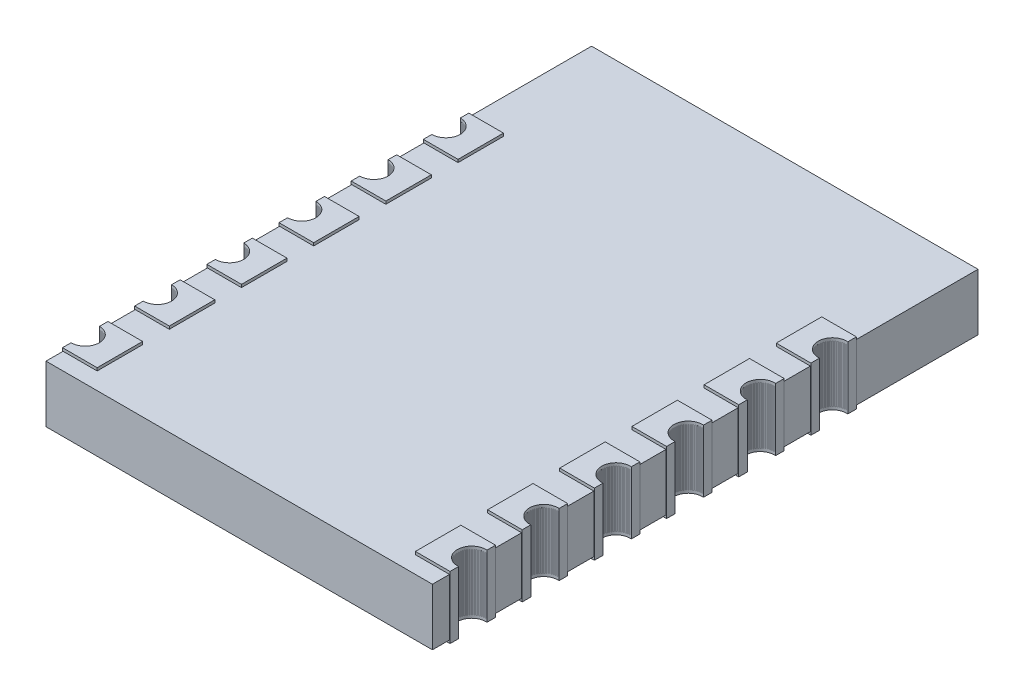
from build123d import *

# Parameters (mm, degrees)
SKETCH_1_W              = 6.8
SKETCH_1_H              = 9.6
EXTRUDE_1_DEPTH         = 1
EXTRUDE_2_DEPTH         = 0.05
EXTRUDE_2_DEPTH_BACK    = 1.05
SKETCH_2_W              = 0.61
SKETCH_2_H              = 0.8
EXTRUDE_2_2_DEPTH       = 0.05
EXTRUDE_2_2_DEPTH_BACK  = 1.05
EXTRUDE_2_3_DEPTH       = 0.05
EXTRUDE_2_3_DEPTH_BACK  = 1.05
EXTRUDE_2_4_DEPTH       = 0.05
EXTRUDE_2_4_DEPTH_BACK  = 1.05
EXTRUDE_2_5_DEPTH       = 0.05
EXTRUDE_2_5_DEPTH_BACK  = 1.05
EXTRUDE_2_6_DEPTH       = 0.05
EXTRUDE_2_6_DEPTH_BACK  = 1.05
EXTRUDE_2_7_DEPTH       = 0.05
EXTRUDE_2_7_DEPTH_BACK  = 1.05
EXTRUDE_2_8_DEPTH       = 0.05
EXTRUDE_2_8_DEPTH_BACK  = 1.05
EXTRUDE_2_9_DEPTH       = 0.05
EXTRUDE_2_9_DEPTH_BACK  = 1.05
EXTRUDE_2_10_DEPTH      = 0.05
EXTRUDE_2_10_DEPTH_BACK = 1.05
EXTRUDE_2_11_DEPTH      = 0.05
EXTRUDE_2_11_DEPTH_BACK = 1.05
EXTRUDE_2_12_DEPTH      = 0.05
EXTRUDE_2_12_DEPTH_BACK = 1.05
SKETCH_4_R              = 0.25
CUT_EXTRUDE_2_DEPTH     = 12.821425464


with BuildPart() as part:
    # 草图1 → 凸台-拉伸1 (new body)
    with BuildSketch(Plane(origin=(0, 0, 0), x_dir=(1, 0, 0), z_dir=(0, 1, 0))):
        with Locations((3.4, 4.8)):
            Rectangle(SKETCH_1_W, SKETCH_1_H)
    extrude(amount=EXTRUDE_1_DEPTH)


with BuildPart() as body_2:
    # 草图2 → 凸台-拉伸2 (new, two sides: drawn at the far end of the back side and taken through both)
    with BuildSketch(Plane(origin=(0, 1, 0), x_dir=(1, 0, 0), z_dir=(0, 1, 0)).offset(-EXTRUDE_2_DEPTH_BACK)):
        with Locations((0.295, 0.7)):
            Rectangle(SKETCH_2_W, SKETCH_2_H)
    extrude(amount=EXTRUDE_2_DEPTH + EXTRUDE_2_DEPTH_BACK)


with BuildPart() as body_3:
    # 草图2 → Extrude 2 2 (new, two sides: drawn at the far end of the back side and taken through both)
    with BuildSketch(Plane(origin=(0, 1, 0), x_dir=(1, 0, 0), z_dir=(0, 1, 0)).offset(-EXTRUDE_2_2_DEPTH_BACK)):
        with Locations((0.295, 1.97)):
            Rectangle(SKETCH_2_W, SKETCH_2_H)
    extrude(amount=EXTRUDE_2_2_DEPTH + EXTRUDE_2_2_DEPTH_BACK)


with BuildPart() as body_4:
    # 草图2 → Extrude 2 3 (new, two sides: drawn at the far end of the back side and taken through both)
    with BuildSketch(Plane(origin=(0, 1, 0), x_dir=(1, 0, 0), z_dir=(0, 1, 0)).offset(-EXTRUDE_2_3_DEPTH_BACK)):
        with Locations((0.295, 3.24)):
            Rectangle(SKETCH_2_W, SKETCH_2_H)
    extrude(amount=EXTRUDE_2_3_DEPTH + EXTRUDE_2_3_DEPTH_BACK)


with BuildPart() as body_5:
    # 草图2 → Extrude 2 4 (new, two sides: drawn at the far end of the back side and taken through both)
    with BuildSketch(Plane(origin=(0, 1, 0), x_dir=(1, 0, 0), z_dir=(0, 1, 0)).offset(-EXTRUDE_2_4_DEPTH_BACK)):
        with Locations((0.295, 4.51)):
            Rectangle(SKETCH_2_W, SKETCH_2_H)
    extrude(amount=EXTRUDE_2_4_DEPTH + EXTRUDE_2_4_DEPTH_BACK)


with BuildPart() as body_6:
    # 草图2 → Extrude 2 5 (new, two sides: drawn at the far end of the back side and taken through both)
    with BuildSketch(Plane(origin=(0, 1, 0), x_dir=(1, 0, 0), z_dir=(0, 1, 0)).offset(-EXTRUDE_2_5_DEPTH_BACK)):
        with Locations((0.295, 5.78)):
            Rectangle(SKETCH_2_W, SKETCH_2_H)
    extrude(amount=EXTRUDE_2_5_DEPTH + EXTRUDE_2_5_DEPTH_BACK)


with BuildPart() as body_7:
    # 草图2 → Extrude 2 6 (new, two sides: drawn at the far end of the back side and taken through both)
    with BuildSketch(Plane(origin=(0, 1, 0), x_dir=(1, 0, 0), z_dir=(0, 1, 0)).offset(-EXTRUDE_2_6_DEPTH_BACK)):
        with Locations((0.295, 7.05)):
            Rectangle(SKETCH_2_W, SKETCH_2_H)
    extrude(amount=EXTRUDE_2_6_DEPTH + EXTRUDE_2_6_DEPTH_BACK)


with BuildPart() as body_8:
    # 草图2 → Extrude 2 7 (new, two sides: drawn at the far end of the back side and taken through both)
    with BuildSketch(Plane(origin=(0, 1, 0), x_dir=(1, 0, 0), z_dir=(0, 1, 0)).offset(-EXTRUDE_2_7_DEPTH_BACK)):
        with Locations((6.505, 7.05)):
            Rectangle(SKETCH_2_W, SKETCH_2_H)
    extrude(amount=EXTRUDE_2_7_DEPTH + EXTRUDE_2_7_DEPTH_BACK)


with BuildPart() as body_9:
    # 草图2 → Extrude 2 8 (new, two sides: drawn at the far end of the back side and taken through both)
    with BuildSketch(Plane(origin=(0, 1, 0), x_dir=(1, 0, 0), z_dir=(0, 1, 0)).offset(-EXTRUDE_2_8_DEPTH_BACK)):
        with Locations((6.505, 5.78)):
            Rectangle(SKETCH_2_W, SKETCH_2_H)
    extrude(amount=EXTRUDE_2_8_DEPTH + EXTRUDE_2_8_DEPTH_BACK)


with BuildPart() as body_10:
    # 草图2 → Extrude 2 9 (new, two sides: drawn at the far end of the back side and taken through both)
    with BuildSketch(Plane(origin=(0, 1, 0), x_dir=(1, 0, 0), z_dir=(0, 1, 0)).offset(-EXTRUDE_2_9_DEPTH_BACK)):
        with Locations((6.505, 4.51)):
            Rectangle(SKETCH_2_W, SKETCH_2_H)
    extrude(amount=EXTRUDE_2_9_DEPTH + EXTRUDE_2_9_DEPTH_BACK)


with BuildPart() as body_11:
    # 草图2 → Extrude 2 10 (new, two sides: drawn at the far end of the back side and taken through both)
    with BuildSketch(Plane(origin=(0, 1, 0), x_dir=(1, 0, 0), z_dir=(0, 1, 0)).offset(-EXTRUDE_2_10_DEPTH_BACK)):
        with Locations((6.505, 3.24)):
            Rectangle(SKETCH_2_W, SKETCH_2_H)
    extrude(amount=EXTRUDE_2_10_DEPTH + EXTRUDE_2_10_DEPTH_BACK)


with BuildPart() as body_12:
    # 草图2 → Extrude 2 11 (new, two sides: drawn at the far end of the back side and taken through both)
    with BuildSketch(Plane(origin=(0, 1, 0), x_dir=(1, 0, 0), z_dir=(0, 1, 0)).offset(-EXTRUDE_2_11_DEPTH_BACK)):
        with Locations((6.505, 0.7)):
            Rectangle(SKETCH_2_W, SKETCH_2_H)
    extrude(amount=EXTRUDE_2_11_DEPTH + EXTRUDE_2_11_DEPTH_BACK)


with BuildPart() as body_13:
    # 草图2 → Extrude 2 12 (new, two sides: drawn at the far end of the back side and taken through both)
    with BuildSketch(Plane(origin=(0, 1, 0), x_dir=(1, 0, 0), z_dir=(0, 1, 0)).offset(-EXTRUDE_2_12_DEPTH_BACK)):
        with Locations((6.505, 1.97)):
            Rectangle(SKETCH_2_W, SKETCH_2_H)
    extrude(amount=EXTRUDE_2_12_DEPTH + EXTRUDE_2_12_DEPTH_BACK)


with BuildPart() as cut_extrude_2_tool:
    # 草图4 → 切除-拉伸2 (new, through all)
    with BuildSketch(Plane(origin=(0, 1.05, 0), x_dir=(1, 0, 0), z_dir=(0, 1, 0))):
        with Locations((-0.01, 0.7)):
            Circle(SKETCH_4_R)
        with Locations((6.79, 0.7)):
            Circle(SKETCH_4_R)
        with Locations((6.79, 1.97)):
            Circle(SKETCH_4_R)
        with Locations((6.79, 3.24)):
            Circle(SKETCH_4_R)
        with Locations((6.79, 4.51)):
            Circle(SKETCH_4_R)
        with Locations((6.79, 5.78)):
            Circle(SKETCH_4_R)
        with Locations((6.79, 7.05)):
            Circle(SKETCH_4_R)
        with Locations((-0.01, 1.97)):
            Circle(SKETCH_4_R)
        with Locations((-0.01, 3.24)):
            Circle(SKETCH_4_R)
        with Locations((-0.01, 4.51)):
            Circle(SKETCH_4_R)
        with Locations((-0.01, 5.78)):
            Circle(SKETCH_4_R)
        with Locations((-0.01, 7.05)):
            Circle(SKETCH_4_R)
    extrude(amount=-CUT_EXTRUDE_2_DEPTH)


with BuildPart() as part_1:
    add(part.part)

    # 切除-拉伸2: cut by cut_extrude_2_tool
    add(cut_extrude_2_tool.part, mode=Mode.SUBTRACT)


with BuildPart() as body_2_1:
    add(body_2.part)

    # 切除-拉伸2: cut by cut_extrude_2_tool
    add(cut_extrude_2_tool.part, mode=Mode.SUBTRACT)


with BuildPart() as body_3_1:
    add(body_3.part)

    # 切除-拉伸2: cut by cut_extrude_2_tool
    add(cut_extrude_2_tool.part, mode=Mode.SUBTRACT)


with BuildPart() as body_4_1:
    add(body_4.part)

    # 切除-拉伸2: cut by cut_extrude_2_tool
    add(cut_extrude_2_tool.part, mode=Mode.SUBTRACT)


with BuildPart() as body_5_1:
    add(body_5.part)

    # 切除-拉伸2: cut by cut_extrude_2_tool
    add(cut_extrude_2_tool.part, mode=Mode.SUBTRACT)


with BuildPart() as body_6_1:
    add(body_6.part)

    # 切除-拉伸2: cut by cut_extrude_2_tool
    add(cut_extrude_2_tool.part, mode=Mode.SUBTRACT)


with BuildPart() as body_7_1:
    add(body_7.part)

    # 切除-拉伸2: cut by cut_extrude_2_tool
    add(cut_extrude_2_tool.part, mode=Mode.SUBTRACT)


with BuildPart() as body_8_1:
    add(body_8.part)

    # 切除-拉伸2: cut by cut_extrude_2_tool
    add(cut_extrude_2_tool.part, mode=Mode.SUBTRACT)


with BuildPart() as body_9_1:
    add(body_9.part)

    # 切除-拉伸2: cut by cut_extrude_2_tool
    add(cut_extrude_2_tool.part, mode=Mode.SUBTRACT)


with BuildPart() as body_10_1:
    add(body_10.part)

    # 切除-拉伸2: cut by cut_extrude_2_tool
    add(cut_extrude_2_tool.part, mode=Mode.SUBTRACT)


with BuildPart() as body_11_1:
    add(body_11.part)

    # 切除-拉伸2: cut by cut_extrude_2_tool
    add(cut_extrude_2_tool.part, mode=Mode.SUBTRACT)


with BuildPart() as body_12_1:
    add(body_12.part)

    # 切除-拉伸2: cut by cut_extrude_2_tool
    add(cut_extrude_2_tool.part, mode=Mode.SUBTRACT)


with BuildPart() as body_13_1:
    add(body_13.part)

    # 切除-拉伸2: cut by cut_extrude_2_tool
    add(cut_extrude_2_tool.part, mode=Mode.SUBTRACT)


solid = Compound([part_1.part, body_2_1.part, body_3_1.part, body_4_1.part, body_5_1.part, body_6_1.part, body_7_1.part, body_8_1.part, body_9_1.part, body_10_1.part, body_11_1.part, body_12_1.part, body_13_1.part])
